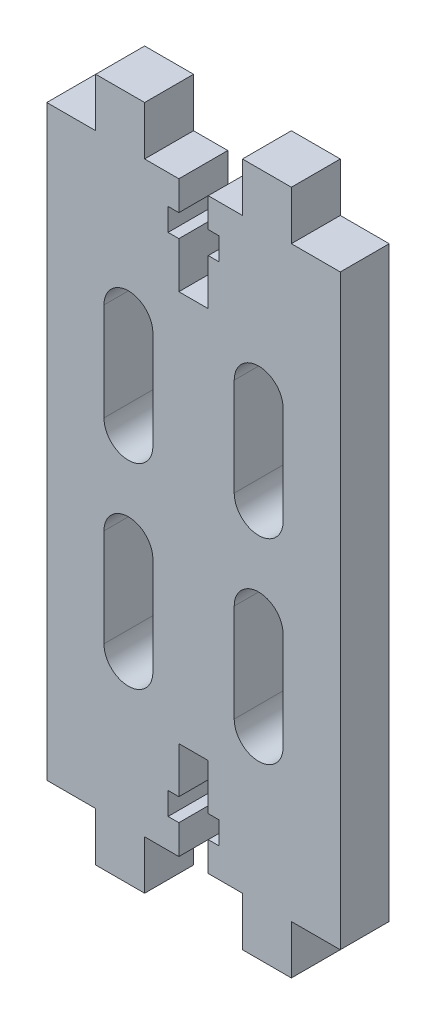
from build123d import *

# Parameters (mm, degrees)
BOSS_EXTRUDE1_DEPTH = 5


with BuildPart() as part:
    # Sketch1 → Boss-Extrude1 (new body)
    with BuildSketch(Plane.XY):
        Polygon((-10, 30), (-15, 30), (-15, -30), (-10, -30), (-10, -35), (-5, -35), (-5, -30), (-1.5, -30), (-1.5, -27), (-2.6, -27), (-2.6, -24.7), (-1.5, -24.7), (-1.5, -20), (1.5, -20), (1.5, -24.7), (2.6, -24.7), (2.6, -27), (1.5, -27), (1.5, -30), (5, -30), (5, -35), (10, -35), (10, -30), (15, -30), (15, 30), (10, 30), (10, 35), (5, 35), (5, 30), (1.5, 30), (1.5, 27), (2.6, 27), (2.6, 24.7), (1.5, 24.7), (1.5, 20), (-1.5, 20), (-1.5, 24.7), (-2.6, 24.7), (-2.6, 27), (-1.5, 27), (-1.5, 30), (-5, 30), (-5, 35), (-10, 35), align=None)
        with BuildLine():
            ThreePointArc((-4.156470727, -15), (-6.656470727, -17.5), (-9.156470727, -15))
            Line((-9.156470727, -15), (-9.156470727, -5))
            ThreePointArc((-9.156470727, -5), (-6.656470727, -2.5), (-4.156470727, -5))
            Line((-4.156470727, -5), (-4.156470727, -15))
        make_face(mode=Mode.SUBTRACT)
        with BuildLine():
            Line((9.156470727, -5), (9.156470727, -15))
            ThreePointArc((9.156470727, -15), (6.656470727, -17.5), (4.156470727, -15))
            Line((4.156470727, -15), (4.156470727, -5))
            ThreePointArc((4.156470727, -5), (6.656470727, -2.5), (9.156470727, -5))
        make_face(mode=Mode.SUBTRACT)
        with BuildLine():
            Line((-9.156470727, 5), (-9.156470727, 15))
            ThreePointArc((-9.156470727, 15), (-6.656470727, 17.5), (-4.156470727, 15))
            Line((-4.156470727, 15), (-4.156470727, 5))
            ThreePointArc((-4.156470727, 5), (-6.656470727, 2.5), (-9.156470727, 5))
        make_face(mode=Mode.SUBTRACT)
        with BuildLine():
            ThreePointArc((4.156470727, 15), (6.656470727, 17.5), (9.156470727, 15))
            Line((9.156470727, 15), (9.156470727, 5))
            ThreePointArc((9.156470727, 5), (6.656470727, 2.5), (4.156470727, 5))
            Line((4.156470727, 5), (4.156470727, 15))
        make_face(mode=Mode.SUBTRACT)
    extrude(amount=BOSS_EXTRUDE1_DEPTH)


solid = part.part
